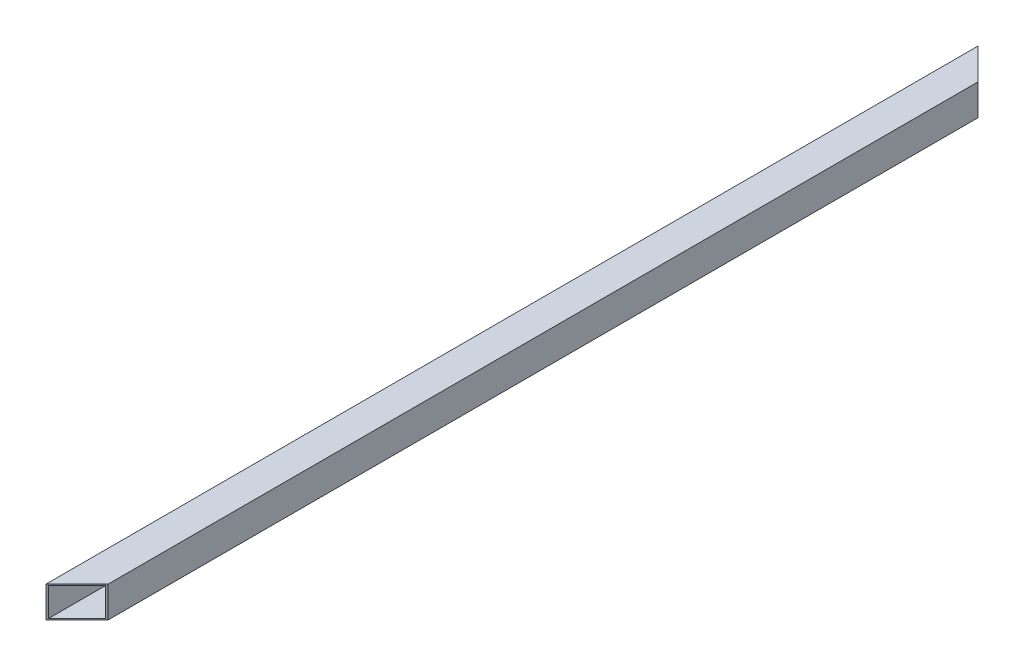
from build123d import *

# Parameters (mm, degrees)
CROQUIS1_W                 = 100
CROQUIS1_H                 = 100
CROQUIS1_W_2               = 92
CROQUIS1_H_2               = 92
SALIENTE_EXTRUIR3_DEPTH    = 3000
CORTAR_EXTRUIR1_DEPTH      = 409
CORTAR_EXTRUIR1_DEPTH_BACK = 390
CORTAR_EXTRUIR2_DEPTH      = 232
CORTAR_EXTRUIR2_DEPTH_BACK = 271


with BuildPart() as part:
    # Croquis1 → Saliente-Extruir3 (new body)
    with BuildSketch(Plane.XY):
        with Locations((-19.634513149, 9.769055649)):
            Rectangle(CROQUIS1_W, CROQUIS1_H)
        with Locations((-19.634513149, 9.769055649)):
            Rectangle(CROQUIS1_W_2, CROQUIS1_H_2, mode=Mode.SUBTRACT)
    extrude(amount=SALIENTE_EXTRUIR3_DEPTH)

    # Croquis2 → Cortar-Extruir1 (cut, two sides: drawn at the far end of the back side and taken through both)
    with BuildSketch(Plane(origin=(0, 59.769055649, 0), x_dir=(1, 0, 0), z_dir=(0, 1, 0)).offset(-CORTAR_EXTRUIR1_DEPTH_BACK)):
        Polygon((-69.634513149, 0), (30.365486851, -100), (30.365486851, 0), align=None)
    extrude(amount=CORTAR_EXTRUIR1_DEPTH + CORTAR_EXTRUIR1_DEPTH_BACK, mode=Mode.SUBTRACT)

    # Croquis3 → Cortar-Extruir2 (cut, two sides: drawn at the far end of the back side and taken through both)
    with BuildSketch(Plane(origin=(0, 59.769055649, 0), x_dir=(1, 0, 0), z_dir=(0, 1, 0)).offset(-CORTAR_EXTRUIR2_DEPTH_BACK)):
        Polygon((-69.634513149, -3000), (30.365486851, -2900), (30.365486851, -3000), align=None)
    extrude(amount=CORTAR_EXTRUIR2_DEPTH + CORTAR_EXTRUIR2_DEPTH_BACK, mode=Mode.SUBTRACT)


solid = part.part
